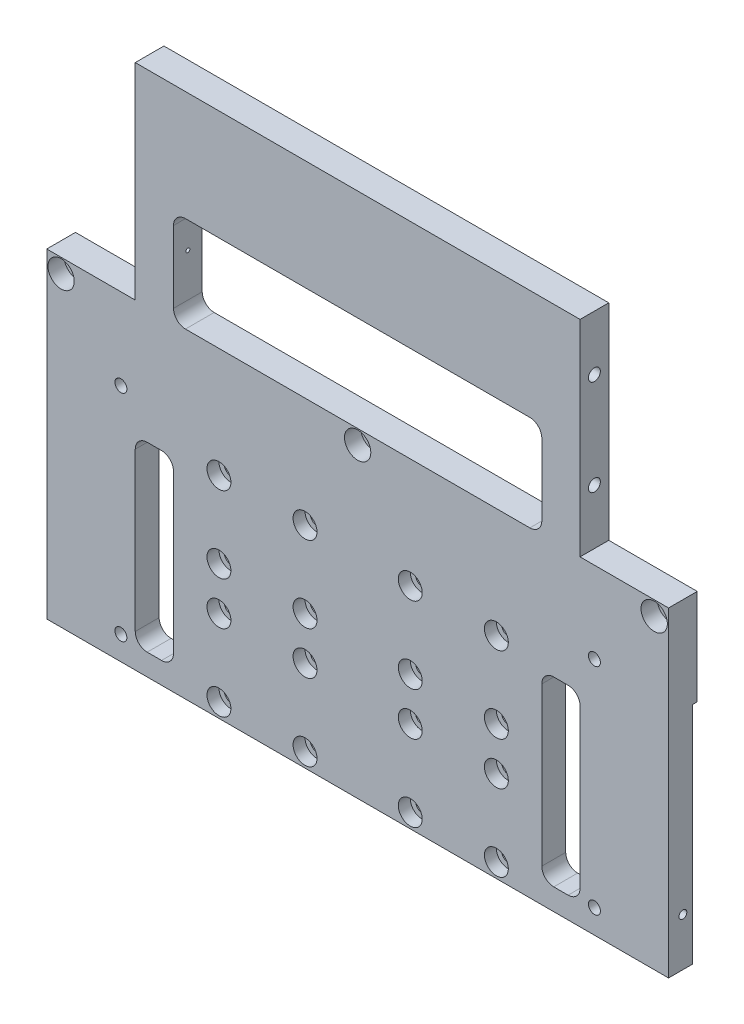
from build123d import *

# Parameters (mm, degrees)
SKETCH_1_W                  = 260
SKETCH_1_H                  = 220
EXTRUDE_1_DEPTH             = 12
SKETCH_2_W                  = 2
SKETCH_2_H                  = 94
CUT_EXTRUDE_1_DEPTH         = 283.56680626
HOLE_WIZARD_1_D             = 5.5
HOLE_WIZARD_1_CBORE_D       = 10
HOLE_WIZARD_1_CBORE_DEPTH   = 5
HOLE_WIZARD_2_D             = 6.6
HOLE_WIZARD_2_CBORE_D       = 11
HOLE_WIZARD_2_CBORE_DEPTH   = 6.8
SKETCH_7_W                  = 37
SKETCH_7_H                  = 86
CUT_EXTRUDE_2_DEPTH         = 171.716138663
HOLE_WIZARD_M6_1_AT_2_COUNT = 2
HOLE_WIZARD_M6_1_AT_2_PITCH = 40
CUT_EXTRUDE_3_DEPTH         = 171.716138663
HOLE_WIZARD_M6_2_D          = 5


with BuildPart() as part:
    # 草图1 → 凸台-拉伸1 (new body)
    with BuildSketch(Plane.XY):
        Rectangle(SKETCH_1_W, SKETCH_1_H)
    extrude(amount=EXTRUDE_1_DEPTH)

    # 草图2 → 切除-拉伸1 (cut, through all)
    with BuildSketch(Plane(origin=(130, 0, 0), x_dir=(0, 0, -1), z_dir=(1, 0, 0))):
        with Locations((-1, -63)):
            Rectangle(SKETCH_2_W, SKETCH_2_H)
    extrude(amount=-CUT_EXTRUDE_1_DEPTH, mode=Mode.SUBTRACT)

    # 打孔尺寸根据内六角圆柱头螺钉的类型1 (through all)
    with Locations(Plane.XY.offset(12)):
        with Locations((-58, -22), (-22, -22), (-22, -54), (-58, -54), (58, -54), (22, -54), (22, -22), (58, -22), (58, -104), (22, -104), (22, -72), (58, -72), (-58, -72), (-22, -72), (-22, -104), (-58, -104)):
            CounterBoreHole(HOLE_WIZARD_1_D / 2, HOLE_WIZARD_1_CBORE_D / 2, HOLE_WIZARD_1_CBORE_DEPTH)

    # 打孔尺寸根据内六角圆柱头螺钉的类型2 (through all)
    with Locations(Plane.XY.offset(12)):
        with Locations((-124, 18), (0, 18), (124, 18)):
            CounterBoreHole(HOLE_WIZARD_2_D / 2, HOLE_WIZARD_2_CBORE_D / 2, HOLE_WIZARD_2_CBORE_DEPTH)

    # 草图7 → 切除-拉伸2 (cut, through all)
    with BuildSketch(Plane.XY.offset(12)):
        with Locations((111.5, 67)):
            Rectangle(SKETCH_7_W, SKETCH_7_H)
        with Locations((-111.5, 67)):
            Rectangle(SKETCH_7_W, SKETCH_7_H)
    extrude(amount=-CUT_EXTRUDE_2_DEPTH, mode=Mode.SUBTRACT)

    # 草图8 → M6 螺纹孔1 (revolve, cut)
    with BuildSketch(Plane(origin=(-93, 87, 6), x_dir=(0, 0, 1), z_dir=(0, 1, 0))):
        Polygon((0, 0), (0, 16.502151548), (2.5, 15), (2.5, 0), align=None)
    hole_wizard_m6_1 = revolve(axis=Axis((-99.35, 87, 6), (1, 0, 0)), mode=Mode.SUBTRACT)

    # M6 螺纹孔1 at 2: M6 螺纹孔1 ×2
    with Locations(*[(0, -i * HOLE_WIZARD_M6_1_AT_2_PITCH, 0) for i in range(1, HOLE_WIZARD_M6_1_AT_2_COUNT)]):
        add(hole_wizard_m6_1, mode=Mode.SUBTRACT)

    # 镜向1: M6 螺纹孔1 across plane
    add(hole_wizard_m6_1.mirror(Plane(origin=(0, 0, 0), x_dir=(0, 0, 1), z_dir=(1, 0, 0))), mode=Mode.SUBTRACT)

    # 镜向1 copy 1 sketch → 镜向1 copy 1 (revolve, cut)
    with BuildSketch(Plane(origin=(93, 47, 6), x_dir=(0, 0, 1), z_dir=(0, 1, 0))):
        Polygon((0, 0), (0, -16.502151548), (2.5, -15), (2.5, 0), align=None)
    revolve(axis=Axis((99.35, 47, 6), (1, 0, 0)), mode=Mode.SUBTRACT)

    # 草图10 → 切除-拉伸3 (cut, through all)
    with BuildSketch(Plane.XY.offset(12)):
        with BuildLine():
            Line((-88, -101), (-82, -101))
            ThreePointArc((-82, -101), (-78.464466094, -99.535533906), (-77, -96))
            Line((-77, -96), (-77, -30))
            ThreePointArc((-77, -30), (-78.464466094, -26.464466094), (-82, -25))
            Line((-82, -25), (-88, -25))
            ThreePointArc((-88, -25), (-91.535533906, -26.464466094), (-93, -30))
            Line((-93, -30), (-93, -96))
            ThreePointArc((-93, -96), (-91.535533906, -99.535533906), (-88, -101))
        make_face()
        with BuildLine():
            Line((-72, 64), (72, 64))
            ThreePointArc((72, 64), (75.535533906, 62.535533906), (77, 59))
            Line((77, 59), (77, 29))
            ThreePointArc((77, 29), (75.535533906, 25.464466094), (72, 24))
            Line((72, 24), (-72, 24))
            ThreePointArc((-72, 24), (-75.535533906, 25.464466094), (-77, 29))
            Line((-77, 29), (-77, 59))
            ThreePointArc((-77, 59), (-75.535533906, 62.535533906), (-72, 64))
        make_face()
        with BuildLine():
            Line((77, -96), (77, -30))
            ThreePointArc((77, -30), (78.464466094, -26.464466094), (82, -25))
            Line((82, -25), (88, -25))
            ThreePointArc((88, -25), (91.535533906, -26.464466094), (93, -30))
            Line((93, -30), (93, -96))
            ThreePointArc((93, -96), (91.535533906, -99.535533906), (88, -101))
            Line((88, -101), (82, -101))
            ThreePointArc((82, -101), (78.464466094, -99.535533906), (77, -96))
        make_face()
    extrude(amount=-CUT_EXTRUDE_3_DEPTH, mode=Mode.SUBTRACT)

    # M6 螺纹孔2 (through all)
    with Locations(Plane.XY.offset(12)):
        with Locations((-99, -10), (-99, -100), (99, -100), (99, -10)):
            Hole(HOLE_WIZARD_M6_2_D / 2)

    # 草图13 → M4 螺纹孔1 (revolve, cut)
    with BuildSketch(Plane(origin=(-130, -90, 6), x_dir=(0, 0, 1), z_dir=(0, 1, 0))):
        Polygon((0, 0), (0, 11.091420021), (1.65, 10.1), (1.65, 0), align=None)
    hole_wizard_m4_1 = revolve(axis=Axis((-136.35, -90, 6), (1, 0, 0)), mode=Mode.SUBTRACT)

    # 镜向2: M4 螺纹孔1 across plane
    add(hole_wizard_m4_1.mirror(Plane(origin=(0, 0, 0), x_dir=(0, 0, 1), z_dir=(1, 0, 0))), mode=Mode.SUBTRACT)


solid = part.part
